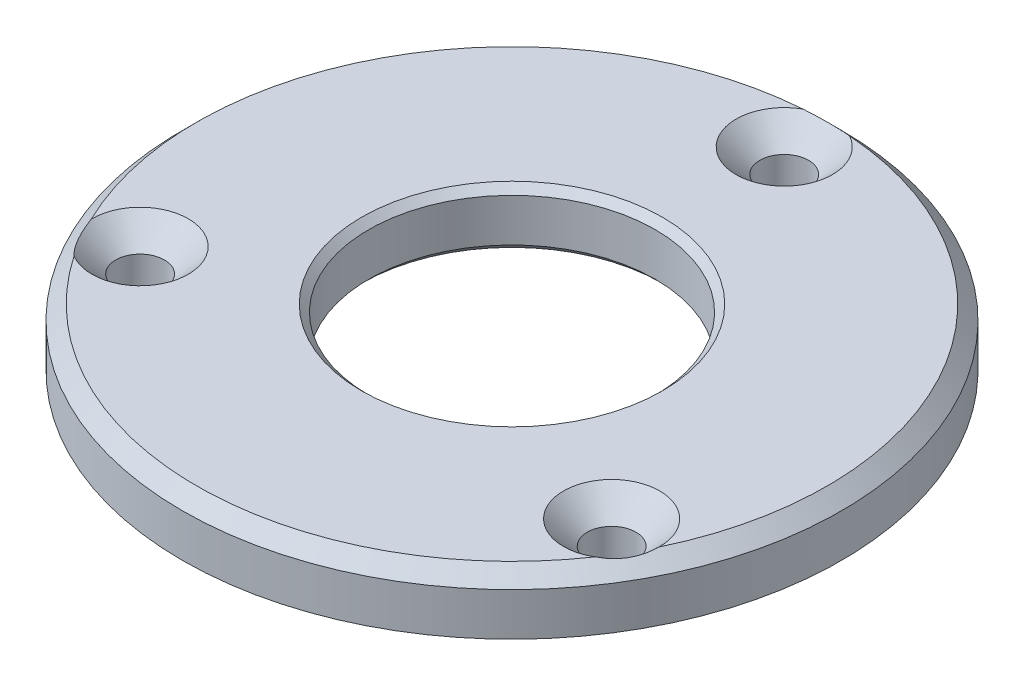
from build123d import *

# Parameters (mm, degrees)
SKETCH1_R                     = 23
SKETCH1_R_2                   = 10
BOSS_EXTRUDE1_DEPTH           = 4
CHAMFER1_SIZE                 = 0.5
CHAMFER2_SIZE                 = 1
CSK_FOR_M3_SFHCS1_D           = 3.4
CSK_FOR_M3_SFHCS1_CSINK_D     = 6.72
CSK_FOR_M3_SFHCS1_CSINK_ANGLE = 90


with BuildPart() as part:
    # Sketch1 → Boss-Extrude1 (new body)
    with BuildSketch(Plane(origin=(0, 0, 0), x_dir=(1, 0, 0), z_dir=(0, 1, 0))):
        with Locations(Location((0, 0, 0), (0, 0, 270))):
            Circle(SKETCH1_R)
        with Locations(Location((0, 0, 0), (0, 0, 270))):
            Circle(SKETCH1_R_2, mode=Mode.SUBTRACT)
    extrude(amount=BOSS_EXTRUDE1_DEPTH)

    # Chamfer1
    chamfer1_edges = [part.edges().sort_by_distance(p)[0] for p in [
        (0, 0, -10),
        (0, 4, -10),
    ]]
    chamfer(chamfer1_edges, length=CHAMFER1_SIZE)

    # Chamfer2
    chamfer2_edges = [part.edges().sort_by_distance(p)[0] for p in [
        (0, 4, -23),
    ]]
    chamfer(chamfer2_edges, length=CHAMFER2_SIZE)

    # CSK for M3 SFHCS1 (through all)
    with Locations(Plane(origin=(0, 4, 0), x_dir=(1, 0, 0), z_dir=(0, 1, 0))):
        with Locations((0, 19), (16.454482672, -9.5), (-16.454482672, -9.5)):
            CounterSinkHole(CSK_FOR_M3_SFHCS1_D / 2, CSK_FOR_M3_SFHCS1_CSINK_D / 2, counter_sink_angle=CSK_FOR_M3_SFHCS1_CSINK_ANGLE)


solid = part.part
